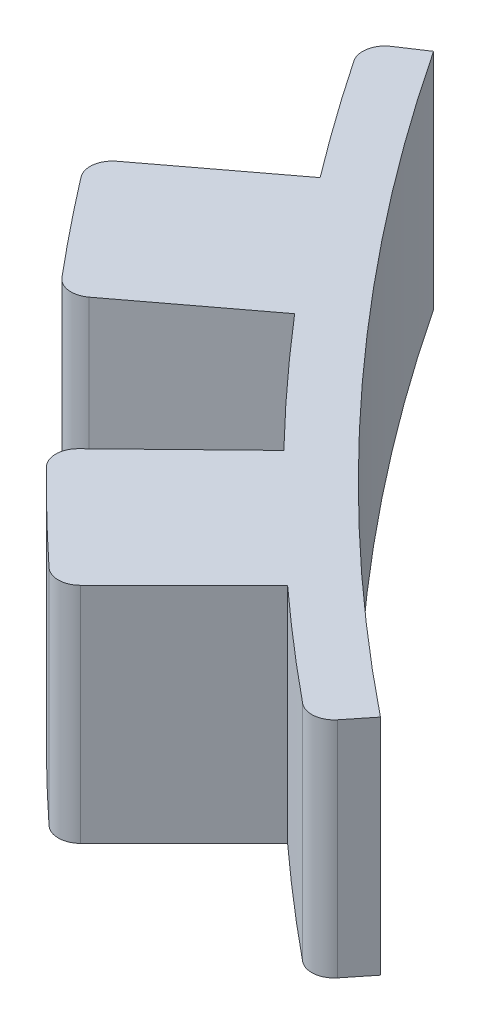
from build123d import *

# Parameters (mm, degrees)
BOSS_EXTRUDE1_DEPTH = 25.4
FILLET1_R           = 2.54


with BuildPart() as part:
    # Sketch1 → Boss-Extrude1 (new body)
    with BuildSketch(Plane(origin=(0, 0, 0), x_dir=(1, 0, 0), z_dir=(0, 1, 0))):
        with BuildLine():
            Line((-244.848924974, -184.847069368), (-240.047965661, -181.222617027))
            ThreePointArc((-240.047965661, -181.222617027), (-245.558733938, -173.682385194), (-250.832740903, -165.974693346))
            Line((-250.832740903, -165.974693346), (-255.849395721, -169.294187212))
            ThreePointArc((-255.849395721, -169.294187212), (-250.469908617, -177.156032898), (-244.848924974, -184.847069368))
        make_face()
        with BuildLine():
            ThreePointArc((-232.905461186, -199.685956603), (-238.99238799, -192.359230601), (-244.848924974, -184.847069368))
            Line((-244.848924974, -184.847069368), (-260.051962799, -196.32450178))
            ThreePointArc((-260.051962799, -196.32450178), (-254.20265496, -203.841466748), (-248.136139057, -211.184255684))
            Line((-248.136139057, -211.184255684), (-232.905461186, -199.685956603))
        make_face()
        with BuildLine():
            ThreePointArc((-215.750093665, -209.562782535), (-228.339131483, -195.770027772), (-240.047965661, -181.222617027))
            Line((-240.047965661, -181.222617027), (-244.848924974, -184.847069368))
            ThreePointArc((-244.848924974, -184.847069368), (-238.99238799, -192.359230601), (-232.905461186, -199.685956603))
            ThreePointArc((-232.905461186, -199.685956603), (-226.594481496, -206.819670414), (-220.065095538, -213.754038186))
            Line((-220.065095538, -213.754038186), (-215.750093665, -209.562782535))
        make_face()
        with BuildLine():
            ThreePointArc((-206.580992956, -226.812099466), (-213.422935618, -220.386219322), (-220.065095538, -213.754038186))
            Line((-220.065095538, -213.754038186), (-233.729268137, -227.026347746))
            ThreePointArc((-233.729268137, -227.026347746), (-226.993847652, -233.760831798), (-220.064468162, -240.295574672))
            Line((-220.064468162, -240.295574672), (-206.580992956, -226.812099466))
        make_face()
        with BuildLine():
            ThreePointArc((-202.530385251, -222.364803398), (-209.238172175, -216.064920904), (-215.750093665, -209.562782535))
            Line((-215.750093665, -209.562782535), (-220.065095538, -213.754038186))
            ThreePointArc((-220.065095538, -213.754038186), (-213.422935618, -220.386219322), (-206.580992956, -226.812099466))
            Line((-206.580992956, -226.812099466), (-202.530385251, -222.364803398))
        make_face()
        with BuildLine():
            ThreePointArc((-188.338885995, -234.506133741), (-195.528897549, -228.545647439), (-202.530385251, -222.364803398))
            Line((-202.530385251, -222.364803398), (-206.580992956, -226.812099466))
            ThreePointArc((-206.580992956, -226.812099466), (-199.4394755, -233.116560388), (-192.105663715, -239.196256416))
            Line((-192.105663715, -239.196256416), (-188.338885995, -234.506133741))
        make_face()
    extrude(amount=BOSS_EXTRUDE1_DEPTH)

    # Fillet1
    fillet1_edges = [part.edges().sort_by_distance(p)[0] for p in [
        (-192.105663715, 12.7, 239.196256416),
        (-220.064468162, 12.7, 240.295574672),
        (-233.729268137, 12.7, 227.026347746),
        (-248.136139057, 12.7, 211.184255684),
        (-260.051962799, 12.7, 196.32450178),
        (-255.849395721, 12.7, 169.294187212),
    ]]
    fillet(fillet1_edges, radius=FILLET1_R)


solid = part.part
